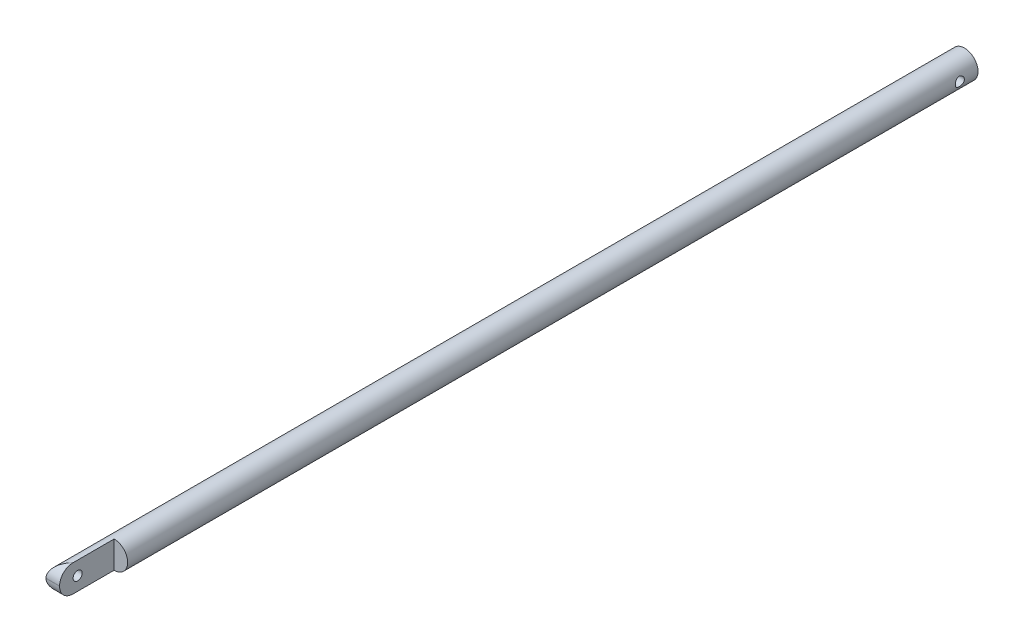
from build123d import *

# Parameters (mm, degrees)
SKETCH_1_R               = 1.49
EXTRUDE_1_DEPTH          = 100
CUT_EXTRUDE_3_DEPTH      = 101.022198536
CUT_EXTRUDE_3_DEPTH_BACK = 101.022198536
SKETCH_4_R               = 0.5
CUT_EXTRUDE_7_DEPTH      = 101.022198639
CUT_EXTRUDE_7_DEPTH_BACK = 101.022198639
SKETCH_2_W               = 1.49
SKETCH_2_H               = 6
SKETCH_6_R               = 0.5
CUT_EXTRUDE_8_DEPTH      = 10
SKETCH_7_R               = 1.49
CUT_EXTRUDE_9_DEPTH      = 0.5


with BuildPart() as part:
    # 草图1 → 凸台-拉伸1 (new body)
    with BuildSketch(Plane.XY):
        Circle(SKETCH_1_R)
    extrude(amount=EXTRUDE_1_DEPTH)

    # 草图4 → 切除-拉伸3 (cut, two sides: drawn at the far end of the back side and taken through both)
    with BuildSketch(Plane(origin=(0, 0, 0), x_dir=(0, 0, -1), z_dir=(1, 0, 0)).offset(-CUT_EXTRUDE_3_DEPTH_BACK)):
        with Locations((-2.5, 0)):
            Circle(SKETCH_4_R)
    extrude(amount=CUT_EXTRUDE_3_DEPTH + CUT_EXTRUDE_3_DEPTH_BACK, mode=Mode.SUBTRACT)

    # 草图2 → 切除-拉伸7 (cut, two sides: drawn at the far end of the back side and taken through both)
    with BuildSketch(Plane(origin=(0, 0, 0), x_dir=(1, 0, 0), z_dir=(0, 1, 0)).offset(-CUT_EXTRUDE_7_DEPTH_BACK)):
        with Locations((0.745, -97)):
            Rectangle(SKETCH_2_W, SKETCH_2_H)
    extrude(amount=CUT_EXTRUDE_7_DEPTH + CUT_EXTRUDE_7_DEPTH_BACK, mode=Mode.SUBTRACT)

    # 草图6 → 切除-拉伸8 (cut)
    with BuildSketch(Plane(origin=(0, 0, 0), x_dir=(0, 0, -1), z_dir=(1, 0, 0))):
        with BuildLine():
            ThreePointArc((-98.52, -1.49), (-99.566518036, -1.056518036), (-100, -0.01))
            Line((-100, -0.01), (-100, -1.49))
            Line((-100, -1.49), (-98.52, -1.49))
        make_face()
        with BuildLine():
            Line((-100, 1.49), (-100, 0.01))
            ThreePointArc((-100, 0.01), (-99.566518036, 1.056518036), (-98.52, 1.49))
            Line((-98.52, 1.49), (-100, 1.49))
        make_face()
        with Locations((-98.01, 0)):
            Circle(SKETCH_6_R)
    extrude(amount=-CUT_EXTRUDE_8_DEPTH, mode=Mode.SUBTRACT)

    # 草图7 → 切除-拉伸9 (cut)
    with BuildSketch(Plane(origin=(0, 0, 0), x_dir=(-1, 0, 0), z_dir=(0, 0, -1))):
        Circle(SKETCH_7_R)
    extrude(amount=-CUT_EXTRUDE_9_DEPTH, mode=Mode.SUBTRACT)


solid = part.part
